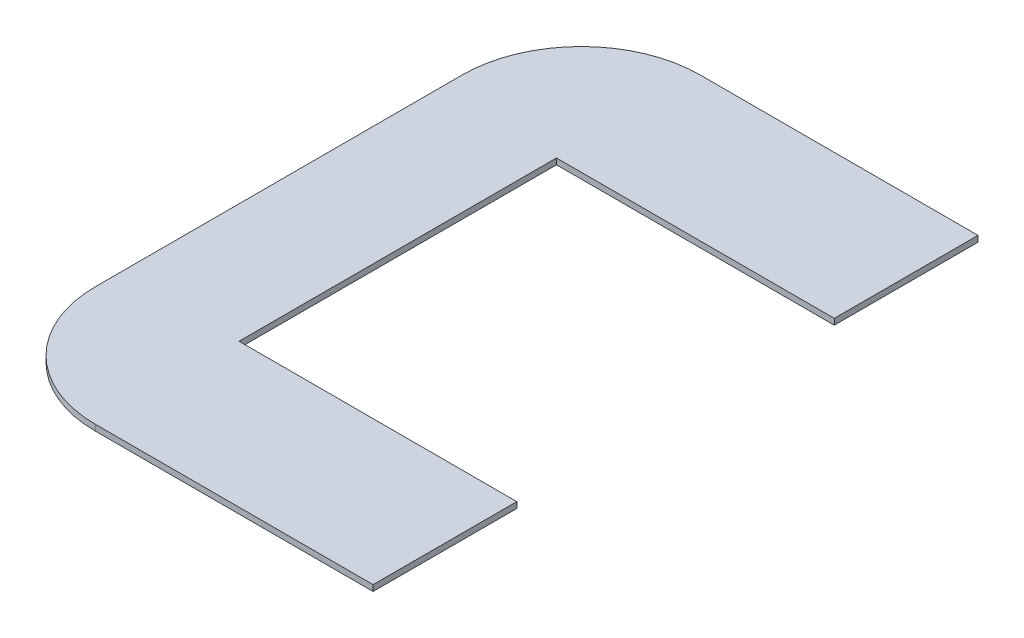
from build123d import *

# Parameters (mm, degrees)
SALIENTE_EXTRUIR1_DEPTH = 3
CROQUIS2_W              = 200
CROQUIS2_H              = 2.56
CORTAR_EXTRUIR1_DEPTH   = 10
CROQUIS3_W              = 140
CROQUIS3_H              = 160
CORTAR_EXTRUIR2_DEPTH   = 10
REDONDEO1_R             = 60


with BuildPart() as part:
    # Croquis1 → Saliente-Extruir1 (new body)
    with BuildSketch(Plane(origin=(0, 0, 0), x_dir=(1, 0, 0), z_dir=(0, 1, 0))):
        Polygon((-100, 155), (0, 155), (0, -155), (-100, -155), (-150, -155), (-200, -155), (-200, 155), (-150, 155), align=None)
    extrude(amount=SALIENTE_EXTRUIR1_DEPTH)

    # Croquis2 → Cortar-Extruir1 (cut)
    with BuildSketch(Plane(origin=(0, 3, 0), x_dir=(1, 0, 0), z_dir=(0, 1, 0))):
        with Locations((-100, 153.72)):
            Rectangle(CROQUIS2_W, CROQUIS2_H)
        with Locations((-100, -153.72)):
            Rectangle(CROQUIS2_W, CROQUIS2_H)
    extrude(amount=-CORTAR_EXTRUIR1_DEPTH, mode=Mode.SUBTRACT)

    # Croquis3 → Cortar-Extruir2 (cut)
    with BuildSketch(Plane(origin=(0, 3, 0), x_dir=(1, 0, 0), z_dir=(0, 1, 0))):
        with Locations((-70, 0)):
            Rectangle(CROQUIS3_W, CROQUIS3_H)
    extrude(amount=-CORTAR_EXTRUIR2_DEPTH, mode=Mode.SUBTRACT)

    # Redondeo1
    redondeo1_edges = [part.edges().sort_by_distance(p)[0] for p in [
        (-200, 1.5, -152.44),
        (-200, 1.5, 152.44),
    ]]
    fillet(redondeo1_edges, radius=REDONDEO1_R)


solid = part.part
